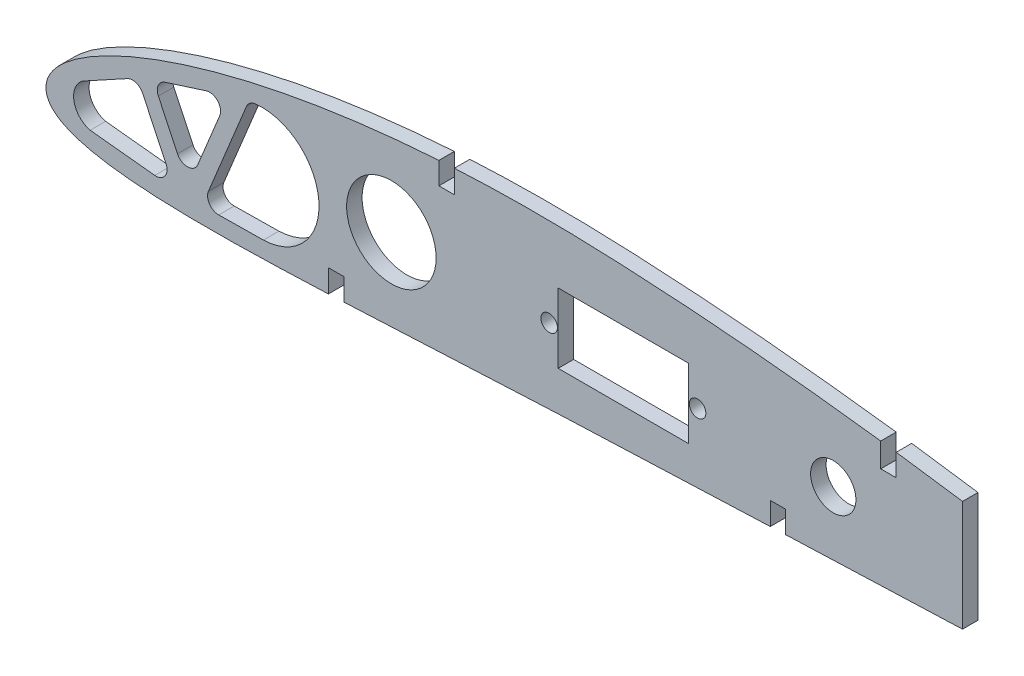
from build123d import *

# Parameters (mm, degrees)
SKETCH_2_R      = 8.1
SKETCH_2_R_2    = 1.5
SKETCH_2_W      = 23.6
SKETCH_2_H      = 12.6
SKETCH_2_R_3    = 4.1
EXTRUDE_2_DEPTH = 1.4


with BuildPart() as part:
    # Эскиз2 → Бобышка-Вытянуть2 (new, symmetric)
    with BuildSketch(Plane.XY):
        with BuildLine():
            Line((165.940456932, 7.493910357), (165.940456932, 18.08535451))
            add(Edge.make_bspline(
                [(165.940456927, 18.085354477), (165.930512982, 18.086853188), (163.740114219, 18.416932942), (159.739714866, 19.000386852), (155.744292591, 19.547112651), (153.932619318, 19.787470759)],
                knots=[0.332761263, 0.332761263, 0.332761263, 0.332761263, 0.332878042, 0.358484538, 0.379707003, 0.379707003, 0.379707003, 0.379707003], degree=3))
            Line((153.932619318, 19.787470759), (153.932619318, 15.787470759))
            Line((153.932619318, 15.787470759), (151.132619318, 15.787470759))
            Line((151.132619318, 15.787470759), (151.132619318, 20.152925753))
            add(Edge.make_bspline(
                [(151.132619318, 20.152925753), (149.51271539, 20.360855756), (145.712882211, 20.834305053), (139.731359791, 21.525676112), (133.19183673, 22.212004248), (126.658683026, 22.825721427), (120.136770918, 23.363973264), (113.62856714, 23.824677322), (107.152732037, 24.200242592), (100.741095693, 24.498399508), (94.411752715, 24.686649766), (88.155917993, 24.740095648), (81.949043055, 24.658849141), (77.212383792, 24.491578654), (74.545027167, 24.35694527), (73.932619318, 24.323871534)],
                knots=[0.390637302, 0.390637302, 0.390637302, 0.390637302, 0.409602822, 0.435103874, 0.460559416, 0.485959195, 0.51130307, 0.536551515, 0.561723366, 0.586628867, 0.611085431, 0.6352512, 0.659272176, 0.683163753, 0.690285585, 0.690285585, 0.690285585, 0.690285585], degree=3))
            Line((73.932619318, 24.323871534), (73.932619318, 20.157469486))
            Line((73.932619318, 20.157469486), (71.132619318, 20.157469486))
            Line((71.132619318, 20.157469486), (71.132619318, 24.157469486))
            add(Edge.make_bspline(
                [(71.132619318, 24.157469486), (70.635982629, 24.125241372), (68.110579653, 23.953963558), (63.575410502, 23.578006358), (57.555189551, 22.924946655), (51.605762689, 22.119065518), (45.744400312, 21.156564429), (39.995857594, 20.035371386), (34.397919843, 18.75631623), (29.010382104, 17.327615604), (23.925798409, 15.771864917), (19.27067884, 14.13426943), (15.179098392, 12.483335433), (11.740475791, 10.89561099), (8.959371869, 9.429577361), (6.760891181, 8.108603195), (5.033709749, 6.92463805), (3.671694934, 5.85422966), (2.592101124, 4.871305364), (1.738175669, 3.952595739), (1.069870831, 3.080946369), (0.571645411, 2.241622098), (0.2157739, 1.430785392), (0.102255582, 0.88324169), (0.047975001, 0.621424995)],
                knots=[0.701142916, 0.701142916, 0.701142916, 0.701142916, 0.706922144, 0.73053591, 0.7539832, 0.77723469, 0.800246382, 0.822950709, 0.845237155, 0.866915896, 0.887662335, 0.906968281, 0.924203157, 0.938878975, 0.950931611, 0.960693484, 0.968646729, 0.975232933, 0.980794744, 0.985583761, 0.989781539, 0.993521313, 0.996902113, 1, 1, 1, 1], degree=3))
            add(Edge.make_bspline(
                [(0.047975001, 0.621424995), (0.022713821, 0.373490081), (-0.027820788, -0.12249998), (0.077991213, -0.884434595), (0.349695651, -1.638838075), (0.814331136, -2.365068928), (1.463480781, -3.039275249), (2.290973018, -3.660999474), (3.305928751, -4.235779626), (4.53525562, -4.773674148), (6.029745689, -5.282192169), (7.868981216, -5.765316681), (10.168831393, -6.221716597), (13.07543819, -6.639618735), (16.728115364, -6.992956742), (21.189952097, -7.247345149), (26.399984417, -7.376638853), (32.197398565, -7.376256917), (38.39780676, -7.261436583), (44.752137938, -7.05998551), (49.023344092, -6.886827907), (51.132619318, -6.795360627)],
                knots=[0, 0, 0, 0, 0.002941446, 0.005884319, 0.00901613, 0.012364547, 0.016007934, 0.020036845, 0.024573728, 0.029783835, 0.03589701, 0.04324044, 0.052275965, 0.063634589, 0.077983176, 0.095698161, 0.116520086, 0.13966073, 0.16431217, 0.18991889, 0.214908072, 0.214908072, 0.214908072, 0.214908072], degree=3))
            Line((51.132619318, -6.795360627), (51.132619318, -2.670677263))
            Line((51.132619318, -2.670677263), (53.932619318, -2.670677263))
            Line((53.932619318, -2.670677263), (53.932619318, -6.670677263))
            add(Edge.make_bspline(
                [(53.932619318, -6.670677263), (55.356569482, -6.605720394), (59.058679651, -6.431131786), (65.052094606, -6.13285227), (71.91077271, -5.784005184), (78.771375577, -5.439680462), (85.61049861, -5.110951262), (92.43210759, -4.804953337), (99.255031191, -4.531981668), (106.097378406, -4.278274685), (112.969211681, -4.003089942), (119.864404255, -3.723176202), (125.92308308, -3.47492717), (129.679854903, -3.321735217), (131.132619318, -3.262735091)],
                knots=[0.225966113, 0.225966113, 0.225966113, 0.225966113, 0.242837762, 0.269833583, 0.296993022, 0.324123272, 0.351139107, 0.378035509, 0.404946016, 0.431960837, 0.459078395, 0.4863474, 0.51364083, 0.530850189, 0.530850189, 0.530850189, 0.530850189], degree=3))
            Line((131.132619318, -3.262735091), (131.132619318, 0.850647814))
            Line((131.132619318, 0.850647814), (133.932619318, 0.850647814))
            Line((133.932619318, 0.850647814), (133.932619318, -3.149352186))
            add(Edge.make_bspline(
                [(133.932619318, -3.149352186), (136.150252366, -3.05984138), (140.66441482, -2.879164577), (147.472013762, -2.613922958), (154.352602411, -2.355626415), (160.507662095, -2.135075484), (164.369425992, -2.00299999), (165.940456932, -1.950382964)],
                knots=[0.541906346, 0.541906346, 0.541906346, 0.541906346, 0.568176028, 0.595379569, 0.622543445, 0.64967326, 0.668278692, 0.668278692, 0.668278692, 0.668278692], degree=3))
            Line((165.940456932, -1.950382964), (165.940456932, 7.493910357))
        make_face()
        with BuildLine():
            ThreePointArc((14.721240391, 8.766081587), (16.29867531, 8.913940332), (17.488708089, 7.868002897))
            Line((17.488708089, 7.868002897), (21.725441093, -1.073266618))
            ThreePointArc((21.725441093, -1.073266618), (21.549996986, -3.085882804), (19.709418924, -3.918755509))
            Line((19.709418924, -3.918755509), (7.999391348, -2.690370853))
            ThreePointArc((7.999391348, -2.690370853), (5.078852056, 0.362162442), (6.580135706, 4.311042875))
            Line((6.580135706, 4.311042875), (14.721240391, 8.766081587))
        make_face(mode=Mode.SUBTRACT)
        with BuildLine():
            Line((23.813024955, 1.527110532), (20.342244628, 8.85190119))
            ThreePointArc((20.342244628, 8.85190119), (20.315234657, 10.50521233), (21.542097769, 11.613803404))
            Line((21.542097769, 11.613803404), (29.003823035, 13.992759157))
            ThreePointArc((29.003823035, 13.992759157), (31.082028751, 13.44264333), (31.461008962, 11.326528867))
            Line((31.461008962, 11.326528867), (27.470064023, 1.622782457))
            ThreePointArc((27.470064023, 1.622782457), (25.672695714, 0.384197539), (23.813024955, 1.527110532))
        make_face(mode=Mode.SUBTRACT)
        with BuildLine():
            ThreePointArc((31.277857225, -4.328453595), (29.59717908, -3.452864074), (29.401621993, -1.567898965))
            Line((29.401621993, -1.567898965), (36.28872379, 15.177681436))
            ThreePointArc((36.28872379, 15.177681436), (36.93262885, 16.01260855), (37.911651949, 16.404055587))
            ThreePointArc((37.911651949, 16.404055587), (49.40696202, 6.85120019), (39.366777065, -4.221012142))
            Line((39.366777065, -4.221012142), (31.277857225, -4.328453595))
        make_face(mode=Mode.SUBTRACT)
        with Locations((62.532619318, 8.592254753)):
            Circle(SKETCH_2_R, mode=Mode.SUBTRACT)
        with Locations((91.097584877, 8.663246996)):
            Circle(SKETCH_2_R_2, mode=Mode.SUBTRACT)
        with Locations((104.532584877, 8.646041596)):
            Rectangle(SKETCH_2_W, SKETCH_2_H, mode=Mode.SUBTRACT)
        with Locations((117.967584877, 8.663246996)):
            Circle(SKETCH_2_R_2, mode=Mode.SUBTRACT)
        with Locations((142.532619318, 8.694705966)):
            Circle(SKETCH_2_R_3, mode=Mode.SUBTRACT)
    extrude(amount=EXTRUDE_2_DEPTH, both=True)


solid = part.part
